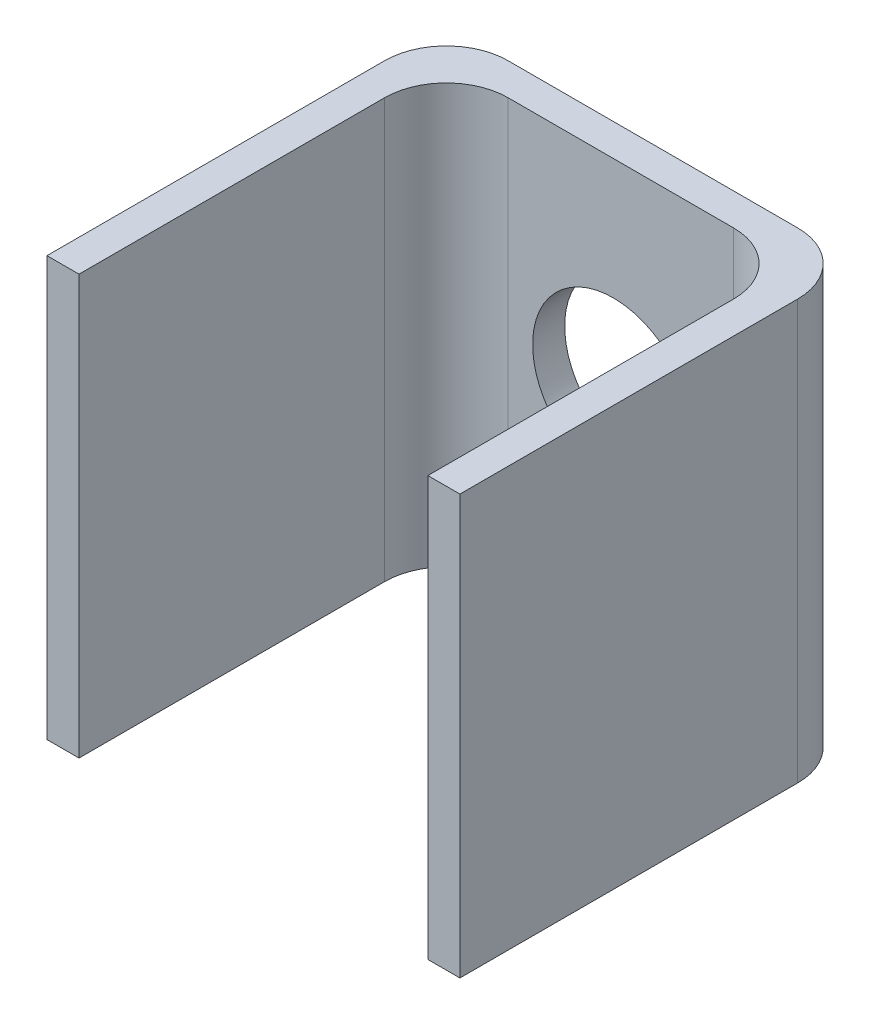
from build123d import *

# Parameters (mm, degrees)
BOSS_EXTRUDE1_DEPTH = 8.636
HOLE1_D             = 3.3274


with BuildPart() as part:
    # Sketch1 → Boss-Extrude1 (new body)
    with BuildSketch(Plane(origin=(0, 11.385459202, 0), x_dir=(-1, 0, 0), z_dir=(0, 1, 0))):
        with BuildLine():
            Line((5.749291724, 0), (11.718291724, 0))
            ThreePointArc((11.718291724, 0), (12.616317336, 0.371974388), (12.988291724, 1.27))
            Line((12.988291724, 1.27), (12.988291724, 8.2296))
            Line((12.988291724, 8.2296), (12.327891724, 8.2296))
            Line((12.327891724, 8.2296), (12.327891724, 1.9304))
            ThreePointArc((12.327891724, 1.9304), (11.955917336, 1.032374388), (11.057891724, 0.6604))
            Line((11.057891724, 0.6604), (6.409691724, 0.6604))
            ThreePointArc((6.409691724, 0.6604), (5.511666112, 1.032374388), (5.139691724, 1.9304))
            Line((5.139691724, 1.9304), (5.139691724, 8.2296))
            Line((5.139691724, 8.2296), (4.479291724, 8.2296))
            Line((4.479291724, 8.2296), (4.479291724, 1.27))
            ThreePointArc((4.479291724, 1.27), (4.851266112, 0.371974388), (5.749291724, 0))
        make_face()
    extrude(amount=-BOSS_EXTRUDE1_DEPTH)

    # Hole1 (through all)
    with Locations(Plane.XY.offset(0.6604)):
        with Locations((-8.886505488, 7.234194178)):
            Hole(HOLE1_D / 2)


solid = part.part
